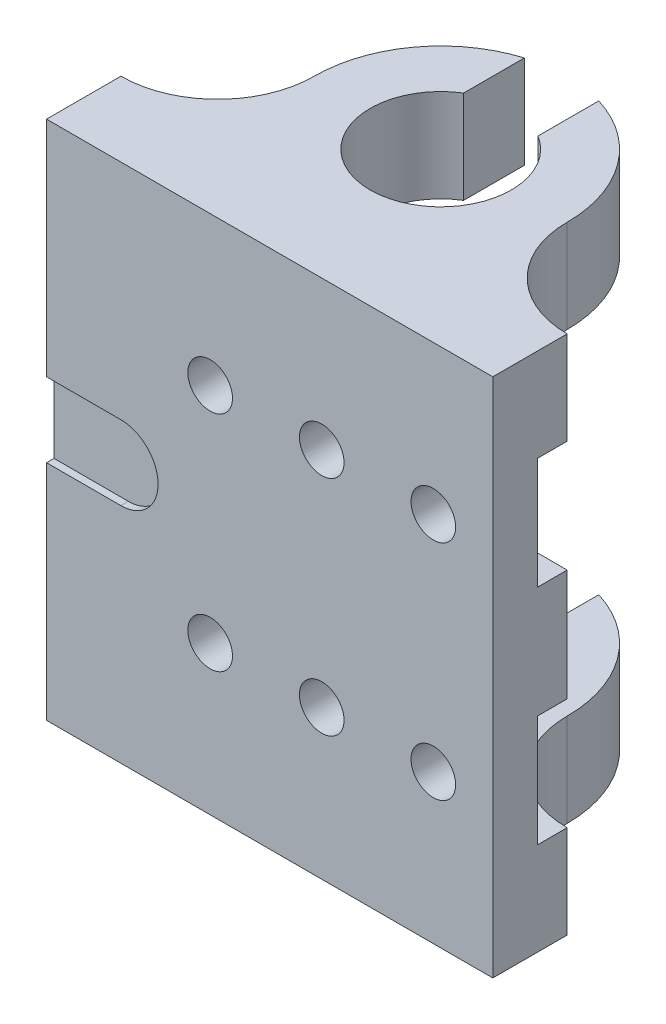
from build123d import *

# Parameters (mm, degrees)
SKETCH_1_W          = 60
SKETCH_1_H          = 70
EXTRUDE_1_DEPTH     = 10
SKETCH_2_R          = 3
CUT_EXTRUDE_1_DEPTH = 48.16990566
CUT_EXTRUDE_START   = -4
SKETCH_3_R          = 7.5
SKETCH_3_R_2        = 3
CUT_EXTRUDE_2_DEPTH = 4
SKETCH_4_R          = 5
CUT_EXTRUDE_3_DEPTH = 1
EXTRUDE_2_DEPTH     = 12.5
SKETCH_7_R          = 9.5
CUT_EXTRUDE_4_DEPTH = 12.5


with BuildPart() as part:
    # 草图1 → 凸台-拉伸1 (new body)
    with BuildSketch(Plane.XY):
        Rectangle(SKETCH_1_W, SKETCH_1_H)
    extrude(amount=EXTRUDE_1_DEPTH)

    # 草图2 → 切除-拉伸1 (cut, through all)
    with BuildSketch(Plane.XY.offset(10)):
        with Locations((-8, 15)):
            Circle(SKETCH_2_R)
        with Locations((7, 15)):
            Circle(SKETCH_2_R)
        with Locations((-8, -15)):
            Circle(SKETCH_2_R)
        with Locations((7, -15)):
            Circle(SKETCH_2_R)
        with Locations((22, 15)):
            Circle(SKETCH_2_R)
        with Locations((22, -15)):
            Circle(SKETCH_2_R)
    extrude(amount=-CUT_EXTRUDE_1_DEPTH, mode=Mode.SUBTRACT)

    # 草图3 → 切除-拉伸2 (cut)
    # profile 1 of 2: a face of its own
    with BuildSketch(Plane(origin=(0, 0, 0), x_dir=(-1, 0, 0), z_dir=(0, 0, -1)).offset(CUT_EXTRUDE_START)):
        with Locations((8, 15)):
            Circle(SKETCH_3_R)
        with Locations(Location((8, 15, 0), (0, 0, 180))):
            Circle(SKETCH_3_R_2, mode=Mode.SUBTRACT)
    # profile 2 of 2: a face of its own
    with BuildSketch(Plane(origin=(0, 0, 0), x_dir=(-1, 0, 0), z_dir=(0, 0, -1)).offset(CUT_EXTRUDE_START)):
        with BuildLine():
            ThreePointArc((8, 7.5), (0.5, 15), (8, 22.5))
            Line((8, 22.5), (-30, 22.5))
            Line((-30, 22.5), (-30, 7.5))
            Line((-30, 7.5), (8, 7.5))
        make_face()
        with Locations(Location((-7, 15, 0), (0, 0, 180))):
            Circle(SKETCH_3_R_2, mode=Mode.SUBTRACT)
    cut_extrude_2 = extrude(amount=CUT_EXTRUDE_2_DEPTH, mode=Mode.SUBTRACT)

    # 镜向1: 切除-拉伸2 across plane
    add(cut_extrude_2.mirror(Plane.ZX), mode=Mode.SUBTRACT)

    # 草图4 → 切除-拉伸3 (cut)
    with BuildSketch(Plane.XY.offset(10)):
        with Locations((-20, 0)):
            Circle(SKETCH_4_R)
        with BuildLine():
            ThreePointArc((-20, -5), (-25, 0), (-20, 5))
            Line((-20, 5), (-30, 5))
            Line((-30, 5), (-30, -5))
            Line((-30, -5), (-20, -5))
        make_face()
    extrude(amount=-CUT_EXTRUDE_3_DEPTH, mode=Mode.SUBTRACT)

    # 草图6 → 凸台-拉伸2 (add)
    with BuildSketch(Plane(origin=(0, 35, 0), x_dir=(1, 0, 0), z_dir=(0, 1, 0))):
        with BuildLine():
            ThreePointArc((30, 0), (20.807611845, 3.807611845), (17, 13))
            ThreePointArc((17, 13), (0, 30), (-17, 13))
            ThreePointArc((-17, 13), (-20.807611845, 3.807611845), (-30, 0))
            Line((-30, 0), (30, 0))
        make_face()
    extrude_2 = extrude(amount=-EXTRUDE_2_DEPTH)

    # 草图7 → 切除-拉伸4 (cut)
    with BuildSketch(Plane(origin=(0, 35, 0), x_dir=(1, 0, 0), z_dir=(0, 1, 0))):
        with Locations((0, 13)):
            Circle(SKETCH_7_R)
        with BuildLine():
            Line((0, 30), (0, 22.5))
            ThreePointArc((0, 22.5), (2.599173089, 22.137521505), (5, 21.077747211))
            Line((5, 21.077747211), (5, 29.248076809))
            ThreePointArc((5, 29.248076809), (2.528111374, 29.810968231), (0, 30))
        make_face()
        with BuildLine():
            ThreePointArc((-5, 21.077747211), (-2.599173089, 22.137521505), (0, 22.5))
            Line((0, 22.5), (0, 30))
            ThreePointArc((0, 30), (-2.528111374, 29.810968231), (-5, 29.248076809))
            Line((-5, 29.248076809), (-5, 21.077747211))
        make_face()
    cut_extrude_4 = extrude(amount=-CUT_EXTRUDE_4_DEPTH, mode=Mode.SUBTRACT)

    # 镜向2: 凸台-拉伸2, 切除-拉伸4 across plane
    add(extrude_2.mirror(Plane.ZX))
    add(cut_extrude_4.mirror(Plane.ZX), mode=Mode.SUBTRACT)


solid = part.part
